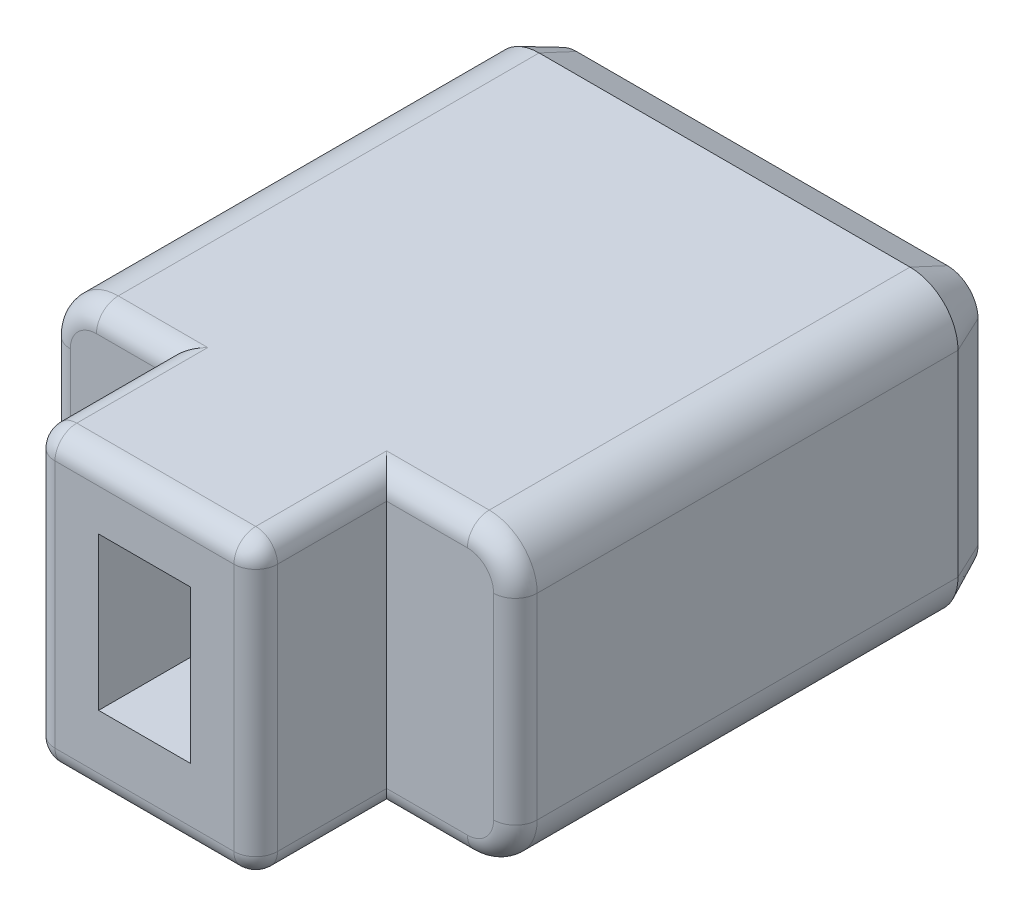
from build123d import *

# Parameters (mm, degrees)
BOSS_EXTRU_1_DEPTH      = 14
ESQUISSE3_W             = 2.1
ESQUISSE3_H             = 3.5
ENL_V_MAT_EXTRU_1_DEPTH = 3
ESQUISSE4_OUTSIDE_W     = 16.47
ESQUISSE4_OUTSIDE_H     = 12.47
ESQUISSE4_OUTSIDE_W_2   = 5.1
ESQUISSE4_OUTSIDE_H_2   = 6.7
ENL_V_MAT_EXTRU_2_DEPTH = 3
CONG_1_R                = 0.5
CHANFREIN1_SIZE         = 0.4
CHANFREIN1_SIZE2        = 0.857802768


with BuildPart() as part:
    # Esquisse2 → Boss.-Extru.1 (new body)
    with BuildSketch(Plane.XY):
        with BuildLine():
            Line((1.1, 0), (9.6, 0))
            ThreePointArc((9.6, 0), (10.377817459, 0.322182541), (10.7, 1.1))
            Line((10.7, 1.1), (10.7, 5.6))
            ThreePointArc((10.7, 5.6), (10.377817459, 6.377817459), (9.6, 6.7))
            Line((9.6, 6.7), (1.1, 6.7))
            ThreePointArc((1.1, 6.7), (0.322182541, 6.377817459), (0, 5.6))
            Line((0, 5.6), (0, 1.1))
            ThreePointArc((0, 1.1), (0.322182541, 0.322182541), (1.1, 0))
        make_face()
    extrude(amount=BOSS_EXTRU_1_DEPTH)

    # Esquisse3 → Enlèv. mat.-Extru.1 (cut)
    with BuildSketch(Plane.XY.offset(14)):
        with Locations((5.2, 3.5)):
            Rectangle(ESQUISSE3_W, ESQUISSE3_H)
    extrude(amount=-ENL_V_MAT_EXTRU_1_DEPTH, mode=Mode.SUBTRACT)

    # Esquisse4 outside → Enlèv. mat.-Extru.2 (cut)
    with BuildSketch(Plane.XY.offset(14)):
        with Locations((5.35, 3.35)):
            Rectangle(ESQUISSE4_OUTSIDE_W, ESQUISSE4_OUTSIDE_H)
        with Locations((5.2, 3.35)):
            Rectangle(ESQUISSE4_OUTSIDE_W_2, ESQUISSE4_OUTSIDE_H_2, mode=Mode.SUBTRACT)
    extrude(amount=-ENL_V_MAT_EXTRU_2_DEPTH, mode=Mode.SUBTRACT)

    # Congé1
    cong_1_edges = [part.edges().sort_by_distance(p)[0] for p in [
        (5.2, 6.7, 14),
        (5.2, 0, 14),
        (10.7, 3.35, 11),
        (1.875, 6.7, 11),
        (0.322182541, 6.377817459, 11),
        (0, 3.35, 11),
        (0.322182541, 0.322182541, 11),
        (1.875, 0, 11),
        (8.675, 0, 11),
        (10.377817459, 0.322182541, 11),
        (10.377817459, 6.377817459, 11),
        (8.675, 6.7, 11),
        (7.75, 6.7, 12.5),
        (7.75, 3.35, 14),
        (7.75, 0, 12.5),
        (2.65, 0, 12.5),
        (2.65, 3.35, 14),
        (2.65, 6.7, 12.5),
    ]]
    fillet(cong_1_edges, radius=CONG_1_R)

    # Chanfrein1
    chanfrein1_edges = [part.edges().sort_by_distance(p)[0] for p in [
        (5.35, 6.7, 0),
        (10.377817459, 6.377817459, 0),
        (10.7, 3.35, 0),
        (10.377817459, 0.322182541, 0),
        (5.35, 0, 0),
        (0.322182541, 0.322182541, 0),
        (0, 3.35, 0),
        (0.322182541, 6.377817459, 0),
    ]]
    chanfrein1_side = [part.faces().sort_by_distance(p)[0] for p in [
        (5.35, 3.35, 0),
    ]]
    chamfer(chanfrein1_edges, length=CHANFREIN1_SIZE, length2=CHANFREIN1_SIZE2, reference=chanfrein1_side[0])


solid = part.part
